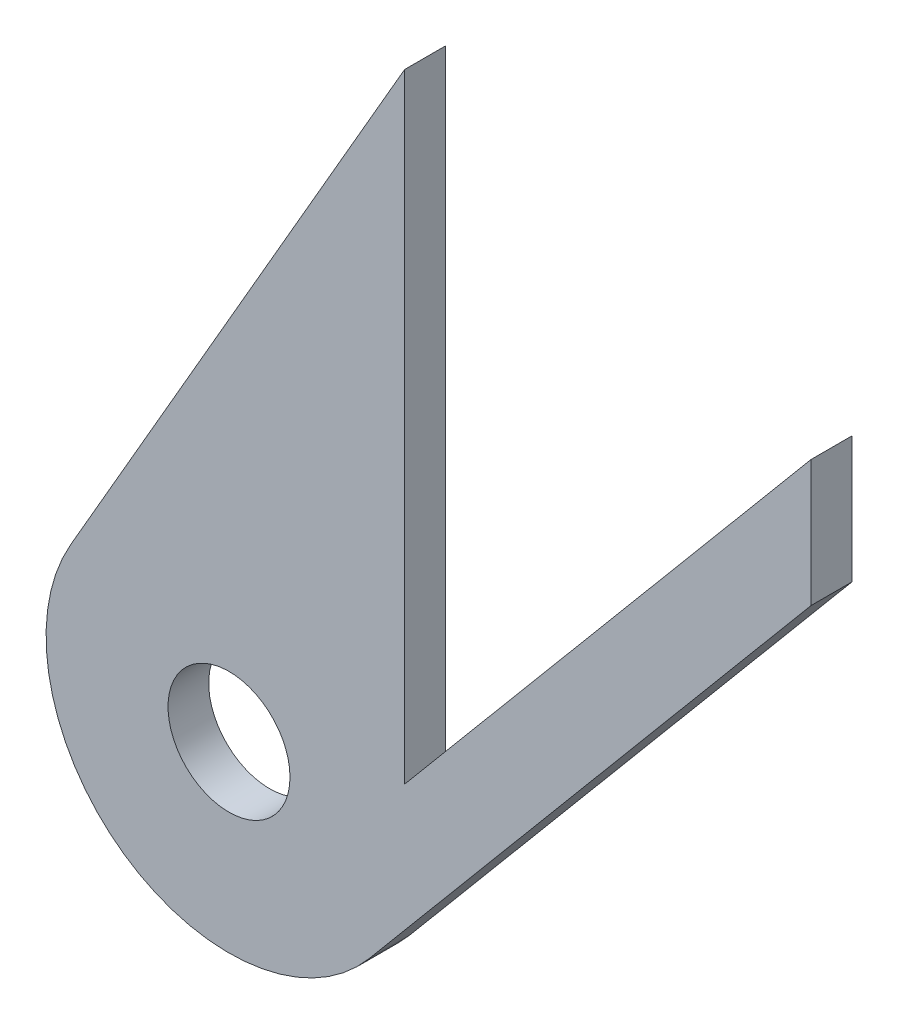
from build123d import *

# Parameters (mm, degrees)
ESQUISSE1_R        = 15
BOSS_EXTRU_1_DEPTH = 10


with BuildPart() as part:
    # Esquisse1 → Boss.-Extru.1 (new body)
    with BuildSketch(Plane.XY):
        with BuildLine():
            Line((-38.97114317, 22.5), (43.202021157, 164.828095634))
            Line((43.202021157, 164.828095634), (43.202021157, 12.59306825))
            Line((43.202021157, 12.59306825), (143.202021157, 131.768427509))
            Line((143.202021157, 131.768427509), (143.202021157, 100.653950972))
            Line((143.202021157, 100.653950972), (34.47199994, -28.925442436))
            ThreePointArc((34.47199994, -28.925442436), (-25.810939636, -36.861841993), (-38.97114317, 22.5))
        make_face()
        Circle(ESQUISSE1_R, mode=Mode.SUBTRACT)
    extrude(amount=BOSS_EXTRU_1_DEPTH)


solid = part.part
